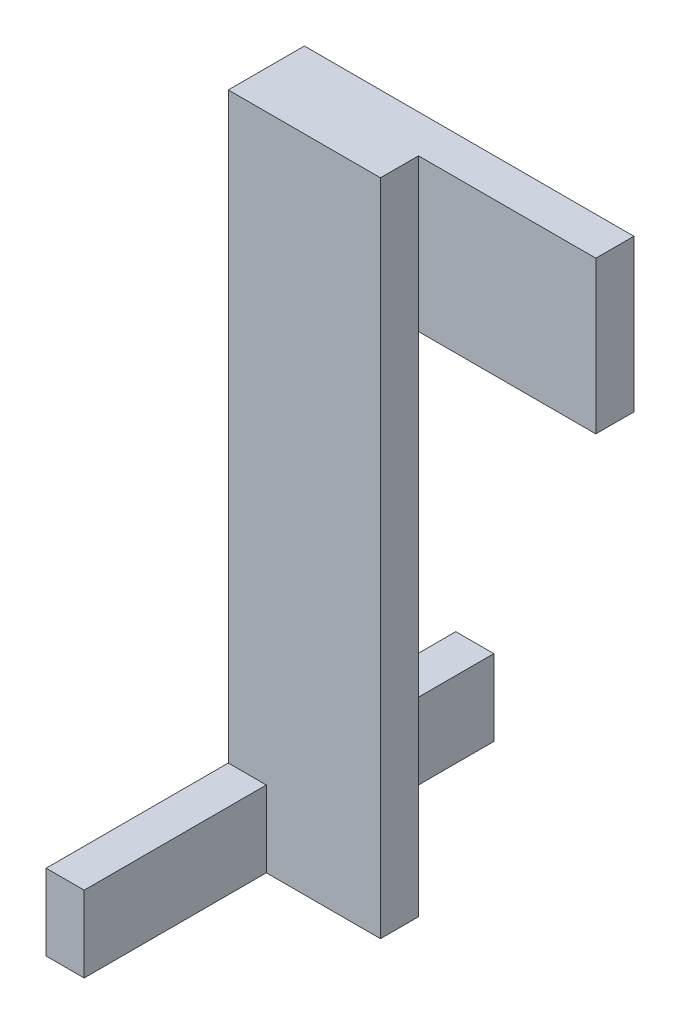
from build123d import *

# Parameters (mm, degrees)
CROQUIS1_W              = 50.8
CROQUIS1_H              = 220
SALIENTE_EXTRUIR1_DEPTH = 12.7
CROQUIS2_W              = 110
CROQUIS2_H              = 50.8
SALIENTE_EXTRUIR2_DEPTH = 12.7
CROQUIS3_W              = 136.757374057
CROQUIS3_H              = 25.4
SALIENTE_EXTRUIR3_DEPTH = 12.7


with BuildPart() as part:
    # Croquis1 → Saliente-Extruir1 (new body)
    with BuildSketch(Plane.XY):
        Rectangle(CROQUIS1_W, CROQUIS1_H)
    extrude(amount=SALIENTE_EXTRUIR1_DEPTH)

    # Croquis2 → Saliente-Extruir2 (add)
    with BuildSketch(Plane(origin=(0, 0, 0), x_dir=(-1, 0, 0), z_dir=(0, 0, -1))):
        with Locations((-29.6, 84.6)):
            Rectangle(CROQUIS2_W, CROQUIS2_H)
    extrude(amount=SALIENTE_EXTRUIR2_DEPTH)

    # Croquis3 → Saliente-Extruir3 (add)
    with BuildSketch(Plane.ZY.offset(25.4)):
        with Locations((5.134235887, -97.3)):
            Rectangle(CROQUIS3_W, CROQUIS3_H)
    extrude(amount=-SALIENTE_EXTRUIR3_DEPTH)


solid = part.part
